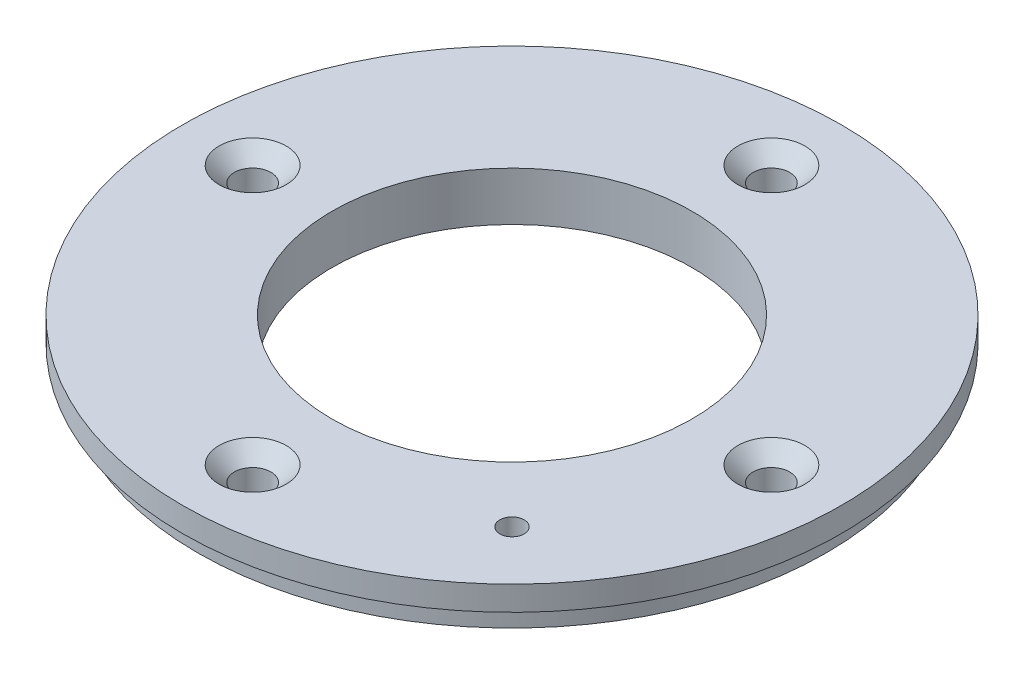
from build123d import *

# Parameters (mm, degrees)
SKETCH_1_R          = 51.5
EXTRUDE_1_DEPTH     = 4
SKETCH_2_R          = 54
EXTRUDE_2_DEPTH     = 4
SKETCH_3_R          = 29.5
CUT_EXTRUDE_1_DEPTH = 10
SKETCH_4_R          = 3
CUT_EXTRUDE_2_DEPTH = 10
CHAMFER_2_SIZE      = 2.5
SKETCH_5_R          = 2
CUT_EXTRUDE_3_DEPTH = 10


with BuildPart() as part:
    # Эскиз1 → Бобышка-Вытянуть1 (new body)
    with BuildSketch(Plane(origin=(0, 0, 0), x_dir=(1, 0, 0), z_dir=(0, 1, 0))):
        with Locations(Location((0, 0, 0), (0, 0, 270))):
            Circle(SKETCH_1_R)
    extrude(amount=EXTRUDE_1_DEPTH)

    # Эскиз2 → Бобышка-Вытянуть2 (add)
    with BuildSketch(Plane(origin=(0, 4, 0), x_dir=(1, 0, 0), z_dir=(0, 1, 0))):
        with Locations(Location((0, 0, 0), (0, 0, 270))):
            Circle(SKETCH_2_R)
    extrude(amount=EXTRUDE_2_DEPTH)

    # Эскиз3 → Вырез-Вытянуть1 (cut)
    with BuildSketch(Plane(origin=(0, 8, 0), x_dir=(1, 0, 0), z_dir=(0, 1, 0))):
        with Locations(Location((0, 0, 0), (0, 0, 270))):
            Circle(SKETCH_3_R)
    extrude(amount=-CUT_EXTRUDE_1_DEPTH, mode=Mode.SUBTRACT)

    # Эскиз4 → Вырез-Вытянуть2 (cut)
    with BuildSketch(Plane(origin=(0, 8, 0), x_dir=(1, 0, 0), z_dir=(0, 1, 0))):
        with Locations(Location((0, 42.5, 0), (0, 0, 270))):
            Circle(SKETCH_4_R)
        with Locations(Location((-42.5, 0, 0), (0, 0, 270))):
            Circle(SKETCH_4_R)
        with Locations(Location((0, -42.5, 0), (0, 0, 270))):
            Circle(SKETCH_4_R)
        with Locations(Location((42.5, 0, 0), (0, 0, 270))):
            Circle(SKETCH_4_R)
    extrude(amount=-CUT_EXTRUDE_2_DEPTH, mode=Mode.SUBTRACT)

    # Фаска2
    chamfer_2_edges = [part.edges().sort_by_distance(p)[0] for p in [
        (0, 8, -45.5),
        (-42.5, 8, -3),
        (0, 8, 39.5),
        (42.5, 8, -3),
    ]]
    chamfer(chamfer_2_edges, length=CHAMFER_2_SIZE)

    # Эскиз5 → Вырез-Вытянуть3 (cut)
    with BuildSketch(Plane(origin=(0, 8, 0), x_dir=(1, 0, 0), z_dir=(0, 1, 0))):
        with Locations(Location((30.0520382, -30.0520382, 0), (0, 0, 270))):
            Circle(SKETCH_5_R)
    extrude(amount=-CUT_EXTRUDE_3_DEPTH, mode=Mode.SUBTRACT)


solid = part.part
